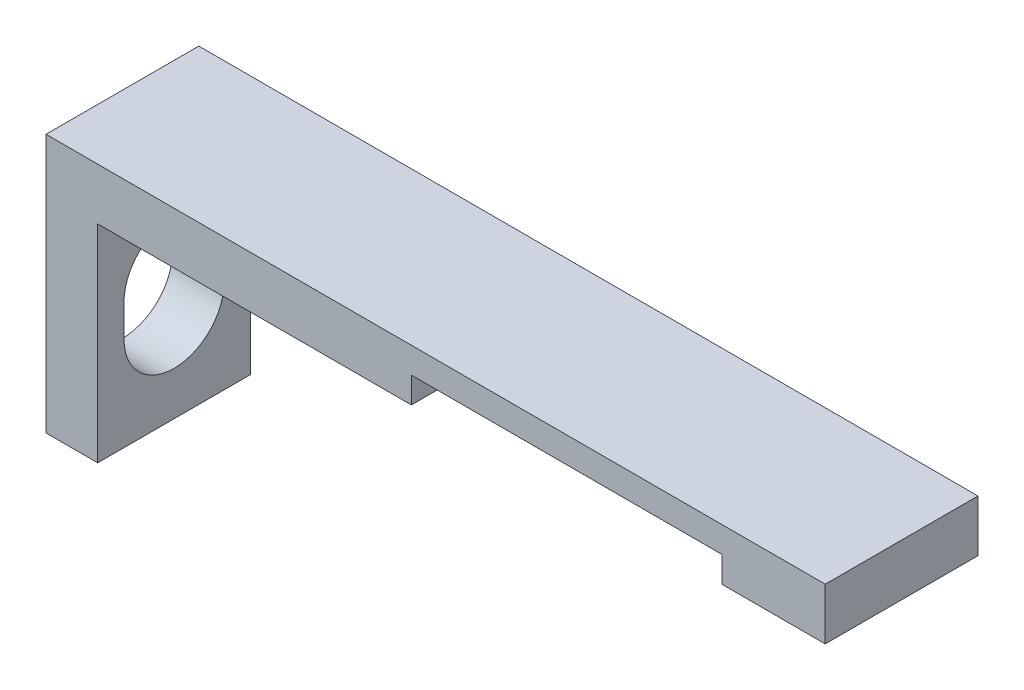
from build123d import *

# Parameters (mm, degrees)
BOSS_EXTRUDE1_DEPTH = 4.725
SKETCH2_W           = 19.2
SKETCH2_H           = 1.6
CUT_EXTRUDE1_DEPTH  = 4.725
CUT_EXTRUDE2_REACH  = 49.993


with BuildPart() as part:
    # Sketch1 → Boss-Extrude1 (new, symmetric)
    with BuildSketch(Plane.XY):
        Polygon((0, 0), (0, 16), (48.2, 16), (48.2, 12.8), (3.2, 12.8), (3.2, 0), align=None)
    extrude(amount=BOSS_EXTRUDE1_DEPTH, both=True)

    # Sketch2 → Cut-Extrude1 (cut, symmetric)
    with BuildSketch(Plane.XY):
        with Locations((32.2, 13.6)):
            Rectangle(SKETCH2_W, SKETCH2_H)
    extrude(amount=CUT_EXTRUDE1_DEPTH, both=True, mode=Mode.SUBTRACT)

    # Sketch3 → Cut-Extrude2 (cut, up to next)
    with BuildSketch(Plane(origin=(3.2, 0, 0), x_dir=(0, 0, -1), z_dir=(1, 0, 0)), mode=Mode.PRIVATE) as cut_extrude2_sk1:
        with BuildLine():
            Line((-3.1, 5.8), (-3.1, 7.8))
            ThreePointArc((-3.1, 7.8), (0, 10.9), (3.1, 7.8))
            Line((3.1, 7.8), (3.1, 5.8))
            ThreePointArc((3.1, 5.8), (0, 2.7), (-3.1, 5.8))
        make_face()
    cut_extrude2_tool1 = extrude(cut_extrude2_sk1.sketch, amount=-CUT_EXTRUDE2_REACH, mode=Mode.PRIVATE) & part.part
    add(cut_extrude2_tool1.solids().sort_by_distance((3.2, 6.8, 0))[0], mode=Mode.SUBTRACT)


solid = part.part
